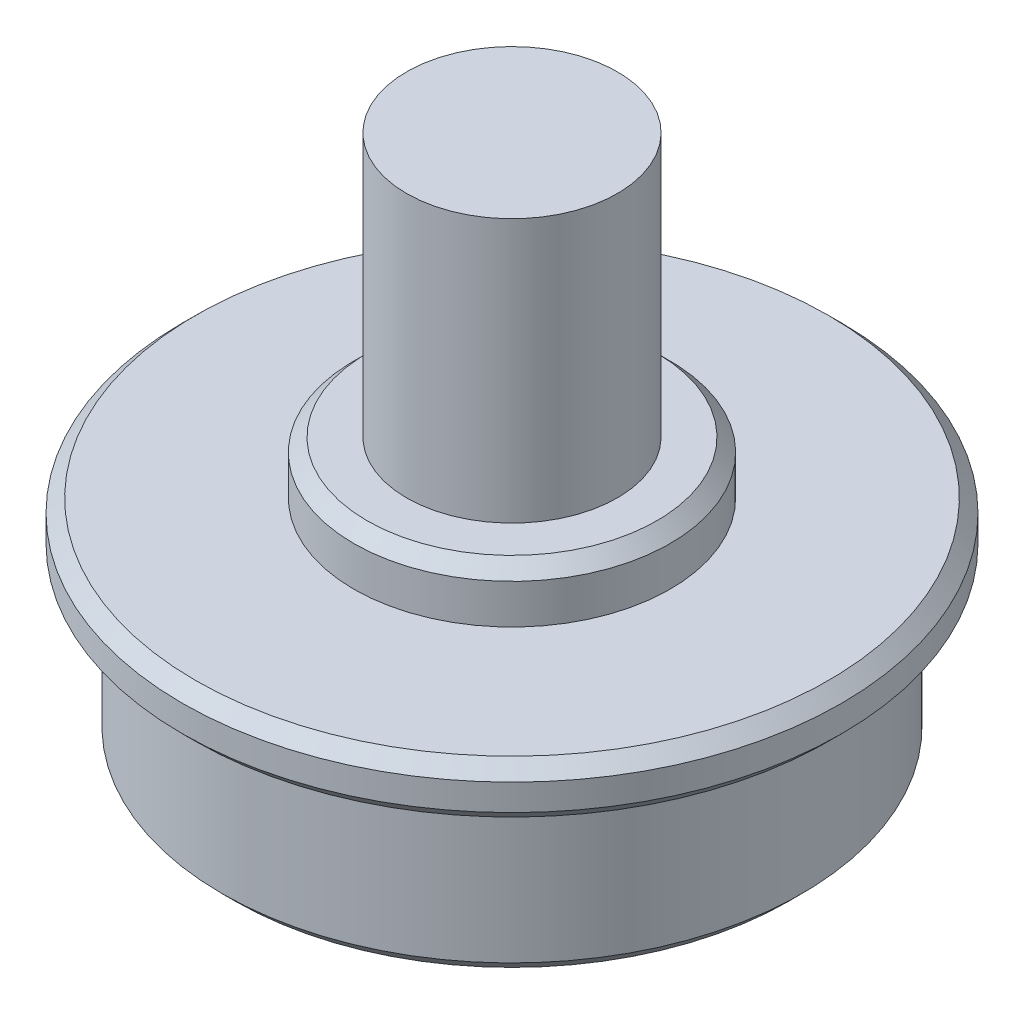
from build123d import *

# Parameters (mm, degrees)
SKETCH1_R           = 6.25
BOSS_EXTRUDE1_DEPTH = 1
SKETCH2_R           = 5.5
BOSS_EXTRUDE2_DEPTH = 3
SKETCH3_R           = 3
BOSS_EXTRUDE3_DEPTH = 1
SKETCH4_R           = 2
BOSS_EXTRUDE4_DEPTH = 5
CHAMFER1_SIZE       = 0.25
CHAMFER2_SIZE       = 0.25


with BuildPart() as part:
    # Sketch1 → Boss-Extrude1 (new body)
    with BuildSketch(Plane(origin=(0, 0, 0), x_dir=(1, 0, 0), z_dir=(0, 1, 0))):
        with Locations(Location((0, 0, 0), (0, 0, 270))):
            Circle(SKETCH1_R)
    extrude(amount=BOSS_EXTRUDE1_DEPTH)

    # Sketch2 → Boss-Extrude2 (add)
    with BuildSketch(Plane.XZ):
        with Locations(Location((0, 0, 0), (0, 0, 270))):
            Circle(SKETCH2_R)
    extrude(amount=BOSS_EXTRUDE2_DEPTH)

    # Sketch3 → Boss-Extrude3 (add)
    with BuildSketch(Plane(origin=(0, 1, 0), x_dir=(1, 0, 0), z_dir=(0, 1, 0))):
        with Locations(Location((0, 0, 0), (0, 0, 270))):
            Circle(SKETCH3_R)
    extrude(amount=BOSS_EXTRUDE3_DEPTH)

    # Sketch4 → Boss-Extrude4 (add)
    with BuildSketch(Plane(origin=(0, 2, 0), x_dir=(1, 0, 0), z_dir=(0, 1, 0))):
        with Locations(Location((0, 0, 0), (0, 0, 270))):
            Circle(SKETCH4_R)
    extrude(amount=BOSS_EXTRUDE4_DEPTH)

    # Chamfer1
    chamfer1_edges = [part.edges().sort_by_distance(p)[0] for p in [
        (0, 0, -6.25),
        (0, 1, -6.25),
        (0, -3, 5.5),
    ]]
    chamfer(chamfer1_edges, length=CHAMFER1_SIZE)

    # Chamfer2
    chamfer2_edges = [part.edges().sort_by_distance(p)[0] for p in [
        (0, 2, -3),
    ]]
    chamfer(chamfer2_edges, length=CHAMFER2_SIZE)


solid = part.part
